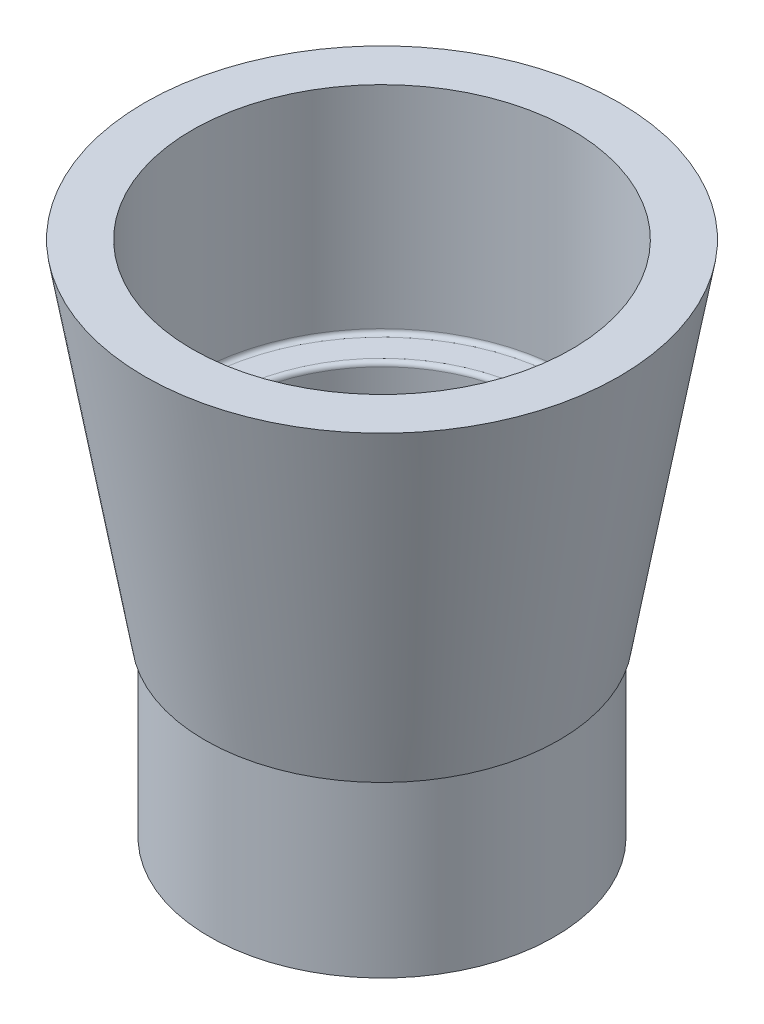
from build123d import *

# Parameters (mm, degrees)
SKETCH6_R           = 25.4
BOSS_EXTRUDE2_DEPTH = 25.4
SKETCH7_R           = 22.86
CUT_EXTRUDE1_DEPTH  = 91.807220253
SKETCH8_R           = 27.94
CUT_EXTRUDE2_DEPTH  = 31.75
FILLET1_R           = 0.635


with BuildPart() as part:
    # Sketch5 → Revolve1 (revolve)
    with BuildSketch(Plane.XY, mode=Mode.PRIVATE) as revolve1_sk:
        Polygon((0, 0), (0, 50.8), (-34.925, 50.8), (-26.0604, 0), align=None)
    revolve(revolve1_sk.sketch.rotate(Axis((0, 0, 0), (0, 1, 0)), 270), axis=Axis((0, 0, 0), (0, 1, 0)))

    # Sketch6 → Boss-Extrude2 (add)
    with BuildSketch(Plane.XZ):
        with Locations(Location((0, 0, 0), (0, 0, 270))):
            Circle(SKETCH6_R)
    extrude(amount=BOSS_EXTRUDE2_DEPTH)

    # Sketch7 → Cut-Extrude1 (cut, through all)
    with BuildSketch(Plane.XZ.offset(25.4)):
        with Locations(Location((0, 0, 0), (0, 0, 270))):
            Circle(SKETCH7_R)
    extrude(amount=-CUT_EXTRUDE1_DEPTH, mode=Mode.SUBTRACT)

    # Sketch8 → Cut-Extrude2 (cut)
    with BuildSketch(Plane(origin=(0, 50.8, 0), x_dir=(1, 0, 0), z_dir=(0, 1, 0))):
        with Locations(Location((0, 0, 0), (0, 0, 270))):
            Circle(SKETCH8_R)
    extrude(amount=-CUT_EXTRUDE2_DEPTH, mode=Mode.SUBTRACT)

    # Fillet1
    fillet1_edges = [part.edges().sort_by_distance(p)[0] for p in [
        (0, 19.05, -27.94),
        (0, 19.05, 22.86),
    ]]
    fillet(fillet1_edges, radius=FILLET1_R)


solid = part.part
